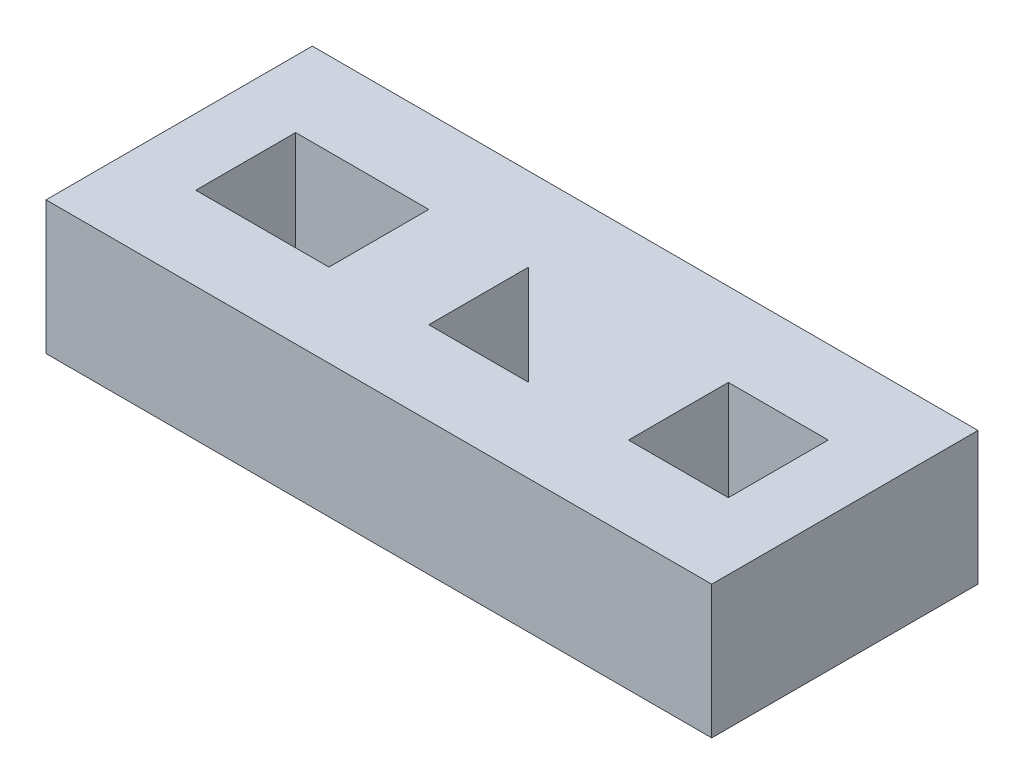
from build123d import *

# Parameters (mm, degrees)
SKETCH1_W           = 127
SKETCH1_H           = 50.8
BOSS_EXTRUDE1_DEPTH = 25.4
SKETCH2_W           = 25.4
SKETCH2_H           = 19.05
SKETCH2_W_2         = 19.05
CUT_EXTRUDE1_DEPTH  = 140.121529606


with BuildPart() as part:
    # Sketch1 → Boss-Extrude1 (new body)
    with BuildSketch(Plane(origin=(0, 0, 0), x_dir=(1, 0, 0), z_dir=(0, 1, 0))):
        with Locations((63.5, 25.4)):
            Rectangle(SKETCH1_W, SKETCH1_H)
    extrude(amount=BOSS_EXTRUDE1_DEPTH)

    # Sketch2 → Cut-Extrude1 (cut, through all)
    with BuildSketch(Plane(origin=(0, 25.4, 0), x_dir=(1, 0, 0), z_dir=(0, 1, 0))):
        Polygon((57.15, 34.925), (57.15, 15.875), (76.2, 15.875), align=None)
        with Locations((25.4, 25.4)):
            Rectangle(SKETCH2_W, SKETCH2_H)
        with Locations((104.775, 25.4)):
            Rectangle(SKETCH2_W_2, SKETCH2_H)
    extrude(amount=-CUT_EXTRUDE1_DEPTH, mode=Mode.SUBTRACT)


solid = part.part
